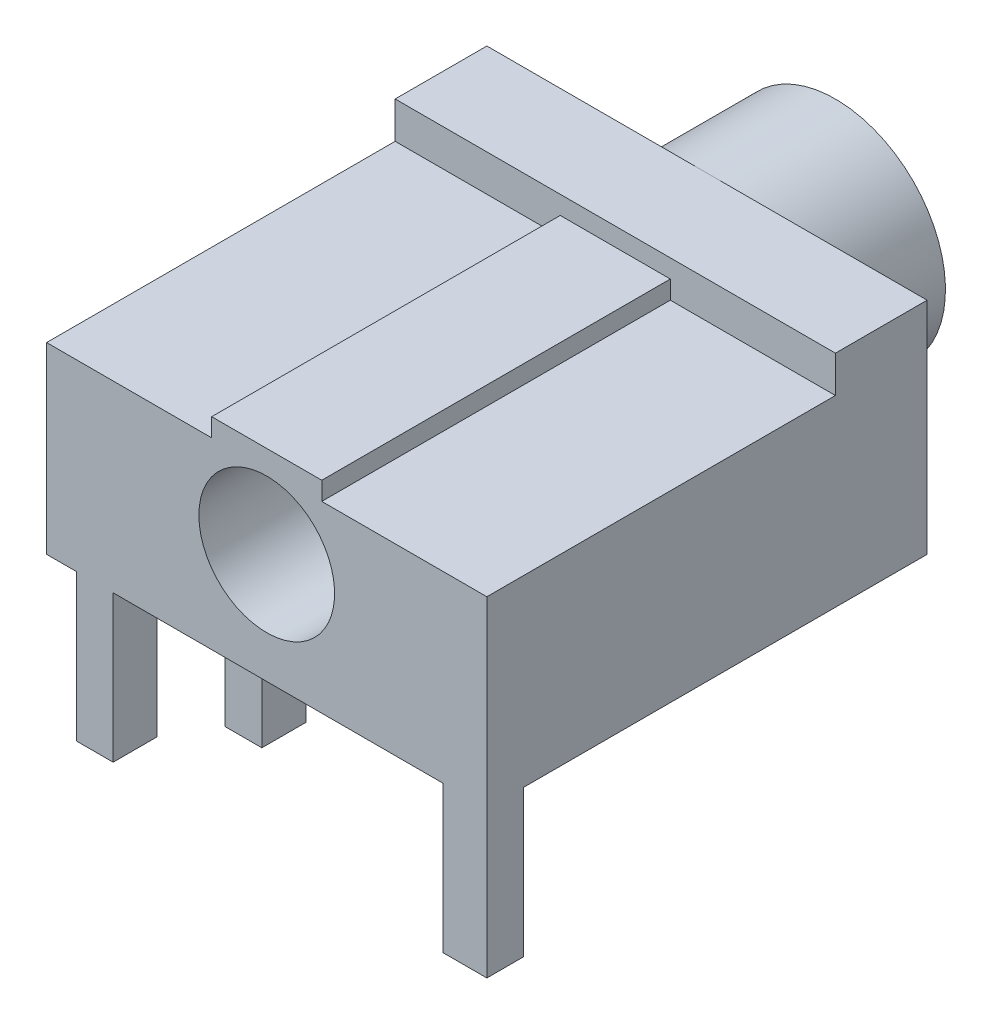
from build123d import *

# Parameters (mm, degrees)
SKETCH1_W           = 12
SKETCH1_H           = 12
BOSS_EXTRUDE1_DEPTH = 6
SKETCH3_W           = 12
SKETCH3_H           = 9.5
CUT_EXTRUDE1_DEPTH  = 1
SKETCH4_W           = 3
SKETCH4_H           = 9.5
BOSS_EXTRUDE2_DEPTH = 0.5
SKETCH6_R           = 3
BOSS_EXTRUDE3_DEPTH = 3.5
SKETCH7_R           = 1.85
CUT_EXTRUDE2_DEPTH  = 21.5
SKETCH8_W           = 1.2
SKETCH8_H           = 1
SKETCH8_W_2         = 1
SKETCH8_H_2         = 1.2
BOSS_EXTRUDE4_DEPTH = 4


with BuildPart() as part:
    # Sketch1 → Boss-Extrude1 (new body)
    with BuildSketch(Plane(origin=(0, 0, 0), x_dir=(1, 0, 0), z_dir=(0, 1, 0))):
        with Locations((-6, 6)):
            Rectangle(SKETCH1_W, SKETCH1_H)
    extrude(amount=BOSS_EXTRUDE1_DEPTH)

    # Sketch3 → Cut-Extrude1 (cut)
    with BuildSketch(Plane(origin=(0, 6, 0), x_dir=(1, 0, 0), z_dir=(0, 1, 0))):
        with Locations((-6, 4.75)):
            Rectangle(SKETCH3_W, SKETCH3_H)
    extrude(amount=-CUT_EXTRUDE1_DEPTH, mode=Mode.SUBTRACT)

    # Sketch4 → Boss-Extrude2 (add)
    with BuildSketch(Plane(origin=(0, 5, 0), x_dir=(1, 0, 0), z_dir=(0, 1, 0))):
        with Locations((-6, 4.75)):
            Rectangle(SKETCH4_W, SKETCH4_H)
    extrude(amount=BOSS_EXTRUDE2_DEPTH)

    # Sketch6 → Boss-Extrude3 (add)
    with BuildSketch(Plane(origin=(0, 0, -12), x_dir=(-1, 0, 0), z_dir=(0, 0, -1))):
        with Locations(Location((6, 3, 0), (0, 0, 270))):
            Circle(SKETCH6_R)
    extrude(amount=BOSS_EXTRUDE3_DEPTH)

    # Sketch7 → Cut-Extrude2 (cut, through all)
    with BuildSketch(Plane(origin=(0, 0, -15.5), x_dir=(-1, 0, 0), z_dir=(0, 0, -1))):
        with Locations((6, 3)):
            Circle(SKETCH7_R)
    extrude(amount=-CUT_EXTRUDE2_DEPTH, mode=Mode.SUBTRACT)

    # Sketch8 → Boss-Extrude4 (add)
    with BuildSketch(Plane.XZ):
        with Locations((-8.9, -11.5)):
            Rectangle(SKETCH8_W, SKETCH8_H)
        with Locations((-10.686701077, -0.6)):
            Rectangle(SKETCH8_W_2, SKETCH8_H_2)
        with Locations((-0.6, -0.5)):
            Rectangle(SKETCH8_W, SKETCH8_H)
        with Locations((-9, -2.967121794)):
            Rectangle(SKETCH8_W_2, SKETCH8_H_2)
    extrude(amount=BOSS_EXTRUDE4_DEPTH)


solid = part.part
